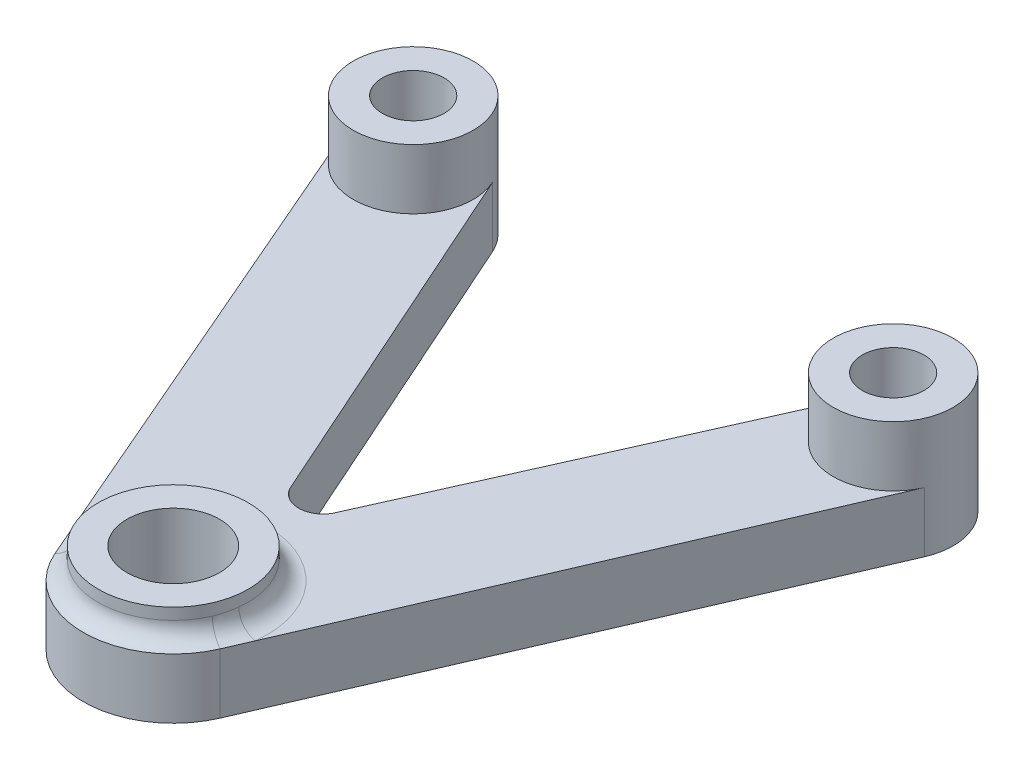
from build123d import *

# Parameters (mm, degrees)
SKETCH1_R                            = 7.9375
BOSS_EXTRUDE1_DEPTH                  = 6.35
F_0_257_DIAMETER_HOLE1_D             = 6.5278
SKETCH1_3_R                          = 7.9375
BOSS_EXTRUDE2_DEPTH                  = 9.525
W_0_386_DIAMETER_HOLE1_D             = 9.8044
FILLET1_R                            = 2
F_25_64_0_39063_DIAMETER_HOLE1_D     = 9.922002
F_25_64_0_39063_DIAMETER_HOLE1_DEPTH = 1.524
BOSS_EXTRUDE3_DEPTH                  = 6.35
BOSS_EXTRUDE3_DEPTH_BACK             = 2.54
SKETCH12_R                           = 6.35
SKETCH12_R_2                         = 3.2639


with BuildPart() as part:
    # Sketch1 → Boss-Extrude1 (new body)
    with BuildSketch(Plane(origin=(0, 0, 0), x_dir=(1, 0, 0), z_dir=(0, 1, 0))):
        with BuildLine():
            ThreePointArc((2.26024053, 17.840513709), (0, 16.529128421), (-2.26024053, 17.840513709))
            Line((-2.26024053, 17.840513709), (-19.602540008, 56.648386542))
            ThreePointArc((-19.602540008, 56.648386542), (-27.954355314, 59.871226792), (-31.229481324, 51.539776269))
            Line((-31.229481324, 51.539776269), (-8.744221986, -0.519156562))
            ThreePointArc((-8.744221986, -0.519156562), (0, -6.267358068), (8.744221986, -0.519156562))
            Line((8.744221986, -0.519156562), (31.229481324, 51.539776269))
            ThreePointArc((31.229481324, 51.539776269), (27.954355314, 59.871226792), (19.602540008, 56.648386542))
            Line((19.602540008, 56.648386542), (2.26024053, 17.840513709))
        make_face()
        with Locations(Location((0, 3.257641932, 0), (0, 0, 270))):
            Circle(SKETCH1_R, mode=Mode.SUBTRACT)
    extrude(amount=BOSS_EXTRUDE1_DEPTH)

    # F (0.257) Diameter Hole1 (through all)
    with Locations(Plane(origin=(0, 6.35, 0), x_dir=(1, 0, 0), z_dir=(0, 1, 0))):
        with Locations((-25.4, 54.057641932), (25.4, 54.057641932)):
            Hole(F_0_257_DIAMETER_HOLE1_D / 2)

    # Sketch1<3> → Boss-Extrude2 (add)
    with BuildSketch(Plane(origin=(0, 0, 0), x_dir=(1, 0, 0), z_dir=(0, 1, 0))):
        with Locations(Location((0, 3.257641932, 0), (0, 0, 90))):
            Circle(SKETCH1_3_R)
    extrude(amount=BOSS_EXTRUDE2_DEPTH)

    # W (0.386) Diameter Hole1 (through all)
    with Locations(Plane(origin=(0, 9.525, 0), x_dir=(1, 0, 0), z_dir=(0, 1, 0))):
        with Locations((0, 3.257641932)):
            Hole(W_0_386_DIAMETER_HOLE1_D / 2)

    # Fillet1
    fillet1_edges = [part.edges().sort_by_distance(p)[0] for p in [
        (0, 6.35, 4.679858068),
    ]]
    fillet(fillet1_edges, radius=FILLET1_R)

    # 25/64 (0.39063) Diameter Hole1
    with Locations(Plane(origin=(0, 6.35, 0), x_dir=(1, 0, 0), z_dir=(0, 1, 0))):
        with Locations((-25.4, 54.057641932), (25.4, 54.057641932)):
            Hole(F_25_64_0_39063_DIAMETER_HOLE1_D / 2, depth=F_25_64_0_39063_DIAMETER_HOLE1_DEPTH)

    # Sketch12 → Boss-Extrude3 (add, two sides: drawn at the far end of the back side and taken through both)
    # profile 1 of 2: a face of its own
    with BuildSketch(Plane(origin=(0, 6.35, 0), x_dir=(1, 0, 0), z_dir=(0, 1, 0)).offset(-BOSS_EXTRUDE3_DEPTH_BACK)):
        with Locations(Location((25.4, 54.057641932, 0), (0, 0, 155.921287707))):
            Circle(SKETCH12_R)
        with Locations(Location((25.4, 54.057641932, 0), (0, 0, 270))):
            Circle(SKETCH12_R_2, mode=Mode.SUBTRACT)
    # profile 2 of 2: a face of its own
    with BuildSketch(Plane(origin=(0, 6.35, 0), x_dir=(1, 0, 0), z_dir=(0, 1, 0)).offset(-BOSS_EXTRUDE3_DEPTH_BACK)):
        with Locations(Location((-25.4, 54.057641932, 0), (0, 0, 24.078712293))):
            Circle(SKETCH12_R)
        with Locations(Location((-25.4, 54.057641932, 0), (0, 0, 270))):
            Circle(SKETCH12_R_2, mode=Mode.SUBTRACT)
    extrude(amount=BOSS_EXTRUDE3_DEPTH + BOSS_EXTRUDE3_DEPTH_BACK)


solid = part.part
